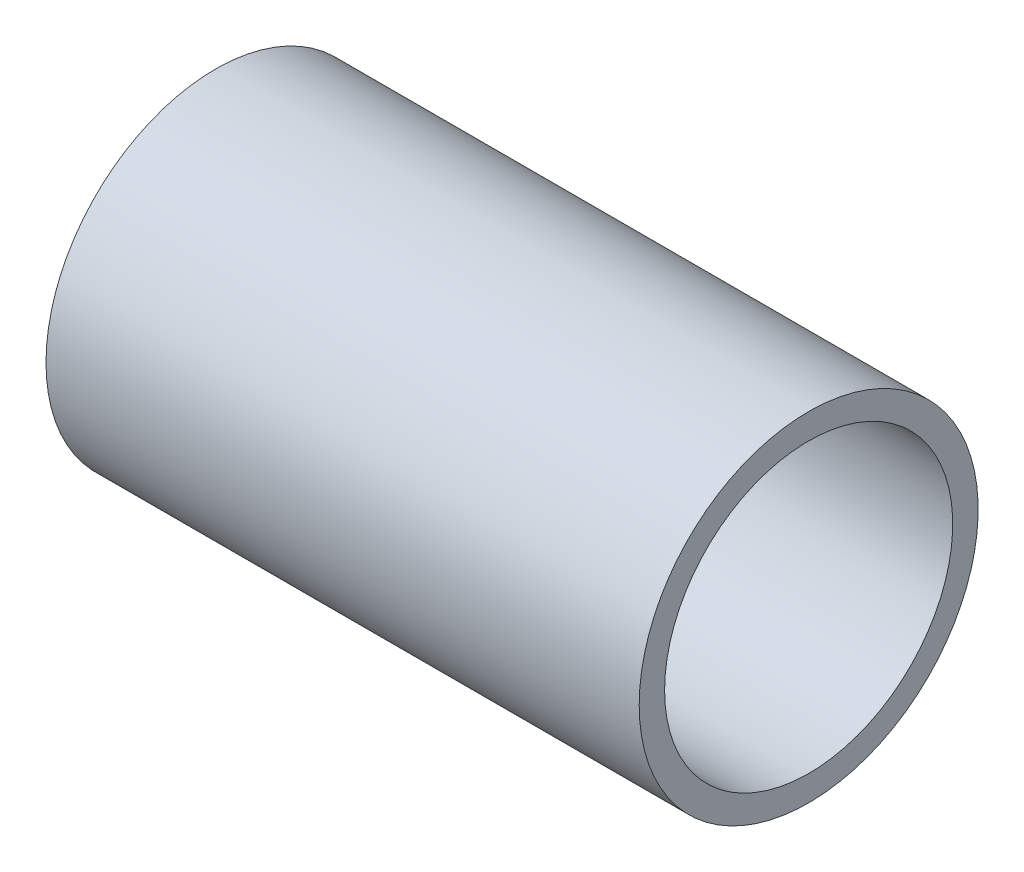
from build123d import *


with BuildPart() as part:
    # Sketch1 → Revolve2 (revolve)
    with BuildSketch(Plane.XY, mode=Mode.PRIVATE) as revolve2_sk:
        with BuildLine():
            Line((338.295772415, 20), (338.295772415, 17))
            Line((338.295772415, 17), (313.295772415, 17))
            Line((313.295772415, 17), (313.295772415, 14.5))
            Line((313.295772415, 14.5), (268.544722908, 14.5))
            ThreePointArc((268.544722908, 14.5), (268.43030124, 17.250455062), (268.295772415, 20))
            Line((268.295772415, 20), (338.295772415, 20))
        make_face()
    revolve(revolve2_sk.sketch.rotate(Axis((-117.115186337, 0, 0), (1, 0, 0)), 90), axis=Axis((-117.115186337, 0, 0), (1, 0, 0)))


solid = part.part
